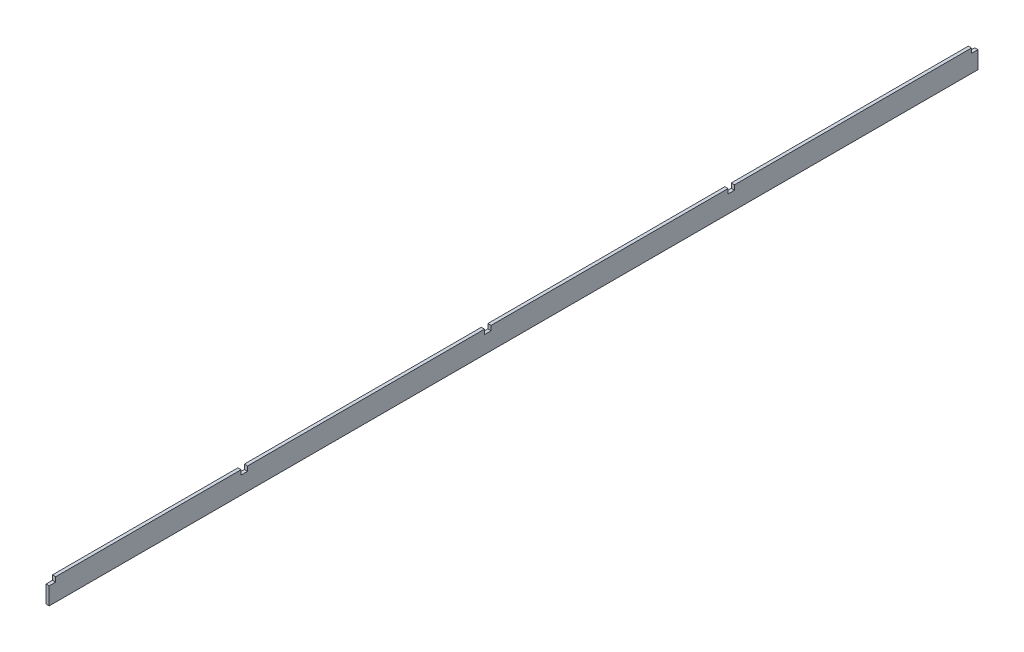
from build123d import *

# Parameters (mm, degrees)
BOSS_EXTRUDE1_DEPTH = 1.5875


with BuildPart() as part:
    # Sketch2 → Boss-Extrude1 (new body)
    with BuildSketch(Plane(origin=(336.19039723, 0, 0), x_dir=(0, 0, -1), z_dir=(1, 0, 0))):
        Polygon((0, 145.84143234), (3.175, 145.84143234), (3.175, 148.134181796), (119.85625, 148.134181796), (119.85625, 145.84143234), (123.03125, 145.84143234), (123.03125, 137.283876296), (119.85625, 137.283876296), (-330.99375, 137.283876296), (-334.16875, 137.283876296), (-334.16875, 145.84143234), (-330.99375, 145.84143234), (-330.99375, 148.134181796), (-239.7125, 148.134181796), (-239.7125, 145.84143234), (-236.5375, 145.84143234), (-236.5375, 148.134181796), (-119.85625, 148.134181796), (-119.85625, 145.84143234), (-116.68125, 145.84143234), (-116.68125, 148.134181796), (0, 148.134181796), align=None)
    extrude(amount=BOSS_EXTRUDE1_DEPTH)


solid = part.part
